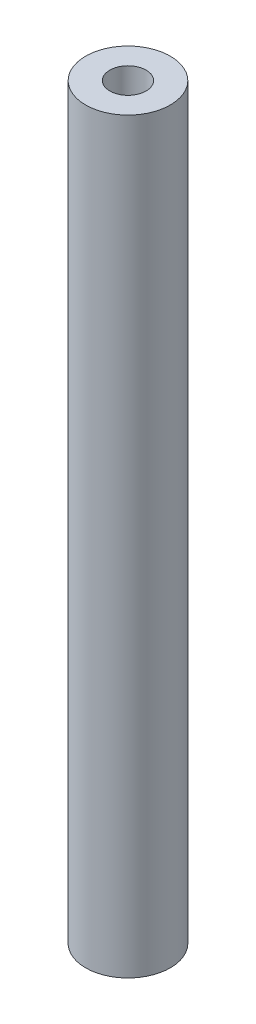
from build123d import *

# Parameters (mm, degrees)
SKETCH1_R           = 3.5
SKETCH1_R_2         = 1.5
BOSS_EXTRUDE1_DEPTH = 61.8


with BuildPart() as part:
    # Sketch1 → Boss-Extrude1 (new body)
    with BuildSketch(Plane(origin=(0, 0, 0), x_dir=(1, 0, 0), z_dir=(0, 1, 0))):
        with Locations(Location((0, 0, 0), (0, 0, 270))):
            Circle(SKETCH1_R)
        with Locations(Location((0, 0, 0), (0, 0, 270))):
            Circle(SKETCH1_R_2, mode=Mode.SUBTRACT)
    extrude(amount=BOSS_EXTRUDE1_DEPTH)


solid = part.part
